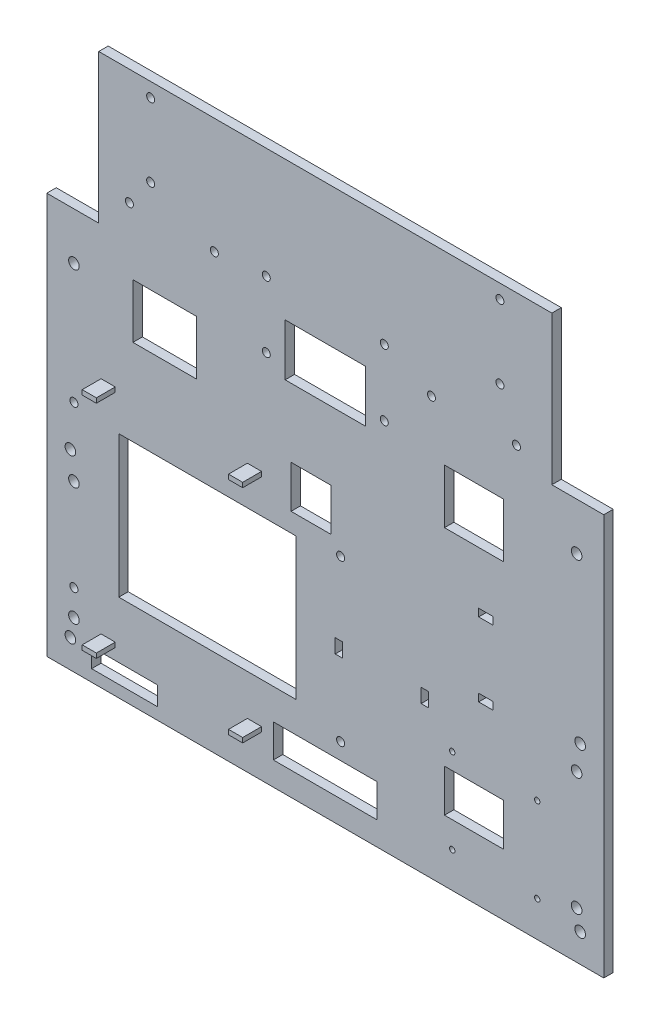
from build123d import *

# Parameters (mm, degrees)
EQUIPMENT_DECK_START                   = 32
EQUIPMENT_DECK_DEPTH                   = 4
EQUIPMENT_AND_CABLE_WINDOWS_START      = 31
SKETCH_EQUIPMENT_AND_CABLE_WINDOWS_W   = 28
SKETCH_EQUIPMENT_AND_CABLE_WINDOWS_H   = 8
SKETCH_EQUIPMENT_AND_CABLE_WINDOWS_W_2 = 44
SKETCH_EQUIPMENT_AND_CABLE_WINDOWS_H_2 = 14
SKETCH_EQUIPMENT_AND_CABLE_WINDOWS_W_3 = 25
SKETCH_EQUIPMENT_AND_CABLE_WINDOWS_H_3 = 18
SKETCH_EQUIPMENT_AND_CABLE_WINDOWS_W_4 = 75
SKETCH_EQUIPMENT_AND_CABLE_WINDOWS_H_4 = 60
SKETCH_EQUIPMENT_AND_CABLE_WINDOWS_W_5 = 17
SKETCH_EQUIPMENT_AND_CABLE_WINDOWS_H_5 = 23
SKETCH_EQUIPMENT_AND_CABLE_WINDOWS_W_6 = 27
SKETCH_EQUIPMENT_AND_CABLE_WINDOWS_W_7 = 34
SKETCH_EQUIPMENT_AND_CABLE_WINDOWS_H_6 = 22
EQUIPMENT_AND_CABLE_WINDOWS_DEPTH      = 6
CHASSIS_M4_START                       = 31
SKETCH_CHASSIS_M4_R                    = 2.25
CHASSIS_M4_DEPTH                       = 6
MID_POSTS_M4_START                     = 31
SKETCH_MID_POSTS_M4_R                  = 2.25
MID_POSTS_M4_DEPTH                     = 6
JETSON_CLAMPS_M3_START                 = 31
SKETCH_JETSON_CLAMPS_M3_R              = 1.7
JETSON_CLAMPS_M3_DEPTH                 = 6
MC02_M2_START                          = 31
SKETCH_MC02_M2_R                       = 1.15
MC02_M2_DEPTH                          = 6
XT_POSTS_M3_START                      = 31
SKETCH_XT_POSTS_M3_R                   = 1.7
XT_POSTS_M3_DEPTH                      = 6
DRIVER_TRAYS_M3_START                  = 31
SKETCH_DRIVER_TRAYS_M3_R               = 1.7
DRIVER_TRAYS_M3_DEPTH                  = 6
CAMERA_M3_START                        = 31
SKETCH_CAMERA_M3_R                     = 1.7
CAMERA_M3_DEPTH                        = 6
LOGIC_AND_FFC_STRAP_SLOTS_START        = 31
SKETCH_LOGIC_AND_FFC_STRAP_SLOTS_W     = 3.2
SKETCH_LOGIC_AND_FFC_STRAP_SLOTS_H     = 6
SKETCH_LOGIC_AND_FFC_STRAP_SLOTS_W_2   = 6
SKETCH_LOGIC_AND_FFC_STRAP_SLOTS_H_2   = 3.2
LOGIC_AND_FFC_STRAP_SLOTS_DEPTH        = 6
JETSON_LONGITUDINAL_STOPS_START        = 36
SKETCH_JETSON_LONGITUDINAL_STOPS_W     = 6
SKETCH_JETSON_LONGITUDINAL_STOPS_H     = 2
JETSON_LONGITUDINAL_STOPS_DEPTH        = 8


with BuildPart() as part:
    # Sketch_Equipment_deck → Equipment_deck (new body)
    with BuildSketch(Plane.XY.offset(EQUIPMENT_DECK_START)):
        Polygon((118, 85), (118, -85), (-118, -85), (-118, 85), (-96, 85), (-96, 148), (96, 148), (96, 85), align=None)
    extrude(amount=EQUIPMENT_DECK_DEPTH)

    # Sketch_Equipment_and_cable_windows → Equipment_and_cable_windows (cut)
    with BuildSketch(Plane.XY.offset(EQUIPMENT_AND_CABLE_WINDOWS_START)):
        with Locations((-85, -76)):
            Rectangle(SKETCH_EQUIPMENT_AND_CABLE_WINDOWS_W, SKETCH_EQUIPMENT_AND_CABLE_WINDOWS_H)
        with Locations((0, -68)):
            Rectangle(SKETCH_EQUIPMENT_AND_CABLE_WINDOWS_W_2, SKETCH_EQUIPMENT_AND_CABLE_WINDOWS_H_2)
        with Locations((63, -50)):
            Rectangle(SKETCH_EQUIPMENT_AND_CABLE_WINDOWS_W_3, SKETCH_EQUIPMENT_AND_CABLE_WINDOWS_H_3)
        with Locations((-50, -18)):
            Rectangle(SKETCH_EQUIPMENT_AND_CABLE_WINDOWS_W_4, SKETCH_EQUIPMENT_AND_CABLE_WINDOWS_H_4)
        with Locations((-6, 29)):
            Rectangle(SKETCH_EQUIPMENT_AND_CABLE_WINDOWS_W_5, SKETCH_EQUIPMENT_AND_CABLE_WINDOWS_H_3)
        with Locations((63, 58)):
            Rectangle(SKETCH_EQUIPMENT_AND_CABLE_WINDOWS_W_3, SKETCH_EQUIPMENT_AND_CABLE_WINDOWS_H_5)
        with Locations((-68, 60)):
            Rectangle(SKETCH_EQUIPMENT_AND_CABLE_WINDOWS_W_6, SKETCH_EQUIPMENT_AND_CABLE_WINDOWS_H_5)
        with Locations((0, 78)):
            Rectangle(SKETCH_EQUIPMENT_AND_CABLE_WINDOWS_W_7, SKETCH_EQUIPMENT_AND_CABLE_WINDOWS_H_6)
    extrude(amount=EQUIPMENT_AND_CABLE_WINDOWS_DEPTH, mode=Mode.SUBTRACT)

    # Sketch_Chassis_M4 → Chassis_M4 (cut)
    with BuildSketch(Plane.XY.offset(CHASSIS_M4_START)):
        with Locations(Location((-106.5, -65, 0), (0, 0, 180))):
            Circle(SKETCH_CHASSIS_M4_R)
        with Locations(Location((-106.5, -15, 0), (0, 0, 180))):
            Circle(SKETCH_CHASSIS_M4_R)
        with Locations(Location((-106.5, 65, 0), (0, 0, 180))):
            Circle(SKETCH_CHASSIS_M4_R)
        with Locations(Location((106.5, -65, 0), (0, 0, 180))):
            Circle(SKETCH_CHASSIS_M4_R)
        with Locations(Location((106.5, -15, 0), (0, 0, 180))):
            Circle(SKETCH_CHASSIS_M4_R)
        with Locations(Location((106.5, 65, 0), (0, 0, 180))):
            Circle(SKETCH_CHASSIS_M4_R)
    extrude(amount=CHASSIS_M4_DEPTH, mode=Mode.SUBTRACT)

    # Sketch_MID_posts_M4 → MID_posts_M4 (cut)
    with BuildSketch(Plane.XY.offset(MID_POSTS_M4_START)):
        with Locations(Location((-108, -73, 0), (0, 0, 180))):
            Circle(SKETCH_MID_POSTS_M4_R)
        with Locations(Location((-108, -4, 0), (0, 0, 180))):
            Circle(SKETCH_MID_POSTS_M4_R)
        with Locations(Location((108, -73, 0), (0, 0, 180))):
            Circle(SKETCH_MID_POSTS_M4_R)
        with Locations(Location((108, -4, 0), (0, 0, 180))):
            Circle(SKETCH_MID_POSTS_M4_R)
    extrude(amount=MID_POSTS_M4_DEPTH, mode=Mode.SUBTRACT)

    # Sketch_Jetson_clamps_M3 → Jetson_clamps_M3 (cut)
    with BuildSketch(Plane.XY.offset(JETSON_CLAMPS_M3_START)):
        with Locations(Location((-106.5, -54, 0), (0, 0, 180))):
            Circle(SKETCH_JETSON_CLAMPS_M3_R)
        with Locations(Location((-106.5, 14, 0), (0, 0, 180))):
            Circle(SKETCH_JETSON_CLAMPS_M3_R)
        with Locations(Location((6.5, -54, 0), (0, 0, 180))):
            Circle(SKETCH_JETSON_CLAMPS_M3_R)
        with Locations(Location((6.5, 14, 0), (0, 0, 180))):
            Circle(SKETCH_JETSON_CLAMPS_M3_R)
    extrude(amount=JETSON_CLAMPS_M3_DEPTH, mode=Mode.SUBTRACT)

    # Sketch_MC02_M2 → MC02_M2 (cut)
    with BuildSketch(Plane.XY.offset(MC02_M2_START)):
        with Locations(Location((53.8, -70, 0), (0, 0, 180))):
            Circle(SKETCH_MC02_M2_R)
        with Locations(Location((53.8, -34, 0), (0, 0, 180))):
            Circle(SKETCH_MC02_M2_R)
        with Locations(Location((89.8, -70, 0), (0, 0, 180))):
            Circle(SKETCH_MC02_M2_R)
        with Locations(Location((89.8, -34, 0), (0, 0, 180))):
            Circle(SKETCH_MC02_M2_R)
    extrude(amount=MC02_M2_DEPTH, mode=Mode.SUBTRACT)

    # Sketch_XT_posts_M3 → XT_posts_M3 (cut)
    with BuildSketch(Plane.XY.offset(XT_POSTS_M3_START)):
        with Locations(Location((-25, 73, 0), (0, 0, 180))):
            Circle(SKETCH_XT_POSTS_M3_R)
        with Locations(Location((-25, 101, 0), (0, 0, 180))):
            Circle(SKETCH_XT_POSTS_M3_R)
        with Locations(Location((25, 73, 0), (0, 0, 180))):
            Circle(SKETCH_XT_POSTS_M3_R)
        with Locations(Location((25, 101, 0), (0, 0, 180))):
            Circle(SKETCH_XT_POSTS_M3_R)
    extrude(amount=XT_POSTS_M3_DEPTH, mode=Mode.SUBTRACT)

    # Sketch_Driver_trays_M3 → Driver_trays_M3 (cut)
    with BuildSketch(Plane.XY.offset(DRIVER_TRAYS_M3_START)):
        with Locations(Location((-83, 99, 0), (0, 0, 180))):
            Circle(SKETCH_DRIVER_TRAYS_M3_R)
        with Locations(Location((-47, 99, 0), (0, 0, 180))):
            Circle(SKETCH_DRIVER_TRAYS_M3_R)
        with Locations(Location((45, 92, 0), (0, 0, 180))):
            Circle(SKETCH_DRIVER_TRAYS_M3_R)
        with Locations(Location((81, 92, 0), (0, 0, 180))):
            Circle(SKETCH_DRIVER_TRAYS_M3_R)
    extrude(amount=DRIVER_TRAYS_M3_DEPTH, mode=Mode.SUBTRACT)

    # Sketch_Camera_M3 → Camera_M3 (cut)
    with BuildSketch(Plane.XY.offset(CAMERA_M3_START)):
        with Locations(Location((-74, 111, 0), (0, 0, 180))):
            Circle(SKETCH_CAMERA_M3_R)
        with Locations(Location((-74, 142, 0), (0, 0, 180))):
            Circle(SKETCH_CAMERA_M3_R)
        with Locations(Location((74, 111, 0), (0, 0, 180))):
            Circle(SKETCH_CAMERA_M3_R)
        with Locations(Location((74, 142, 0), (0, 0, 180))):
            Circle(SKETCH_CAMERA_M3_R)
    extrude(amount=CAMERA_M3_DEPTH, mode=Mode.SUBTRACT)

    # Sketch_Logic_and_FFC_strap_slots → Logic_and_FFC_strap_slots (cut)
    with BuildSketch(Plane.XY.offset(LOGIC_AND_FFC_STRAP_SLOTS_START)):
        with Locations((5.8, -20)):
            Rectangle(SKETCH_LOGIC_AND_FFC_STRAP_SLOTS_W, SKETCH_LOGIC_AND_FFC_STRAP_SLOTS_H)
        with Locations((42.2, -20)):
            Rectangle(SKETCH_LOGIC_AND_FFC_STRAP_SLOTS_W, SKETCH_LOGIC_AND_FFC_STRAP_SLOTS_H)
        with Locations((68, -8.6)):
            Rectangle(SKETCH_LOGIC_AND_FFC_STRAP_SLOTS_W_2, SKETCH_LOGIC_AND_FFC_STRAP_SLOTS_H_2)
        with Locations((68, 22.6)):
            Rectangle(SKETCH_LOGIC_AND_FFC_STRAP_SLOTS_W_2, SKETCH_LOGIC_AND_FFC_STRAP_SLOTS_H_2)
    extrude(amount=LOGIC_AND_FFC_STRAP_SLOTS_DEPTH, mode=Mode.SUBTRACT)

    # Sketch_Jetson_longitudinal_stops → Jetson_longitudinal_stops (add)
    with BuildSketch(Plane.XY.offset(JETSON_LONGITUDINAL_STOPS_START)):
        with Locations((-92, -66.25)):
            Rectangle(SKETCH_JETSON_LONGITUDINAL_STOPS_W, SKETCH_JETSON_LONGITUDINAL_STOPS_H)
        with Locations((-30, -66.25)):
            Rectangle(SKETCH_JETSON_LONGITUDINAL_STOPS_W, SKETCH_JETSON_LONGITUDINAL_STOPS_H)
        with Locations((-92, 27.4)):
            Rectangle(SKETCH_JETSON_LONGITUDINAL_STOPS_W, SKETCH_JETSON_LONGITUDINAL_STOPS_H)
        with Locations((-30, 27.4)):
            Rectangle(SKETCH_JETSON_LONGITUDINAL_STOPS_W, SKETCH_JETSON_LONGITUDINAL_STOPS_H)
    extrude(amount=JETSON_LONGITUDINAL_STOPS_DEPTH)


solid = part.part
